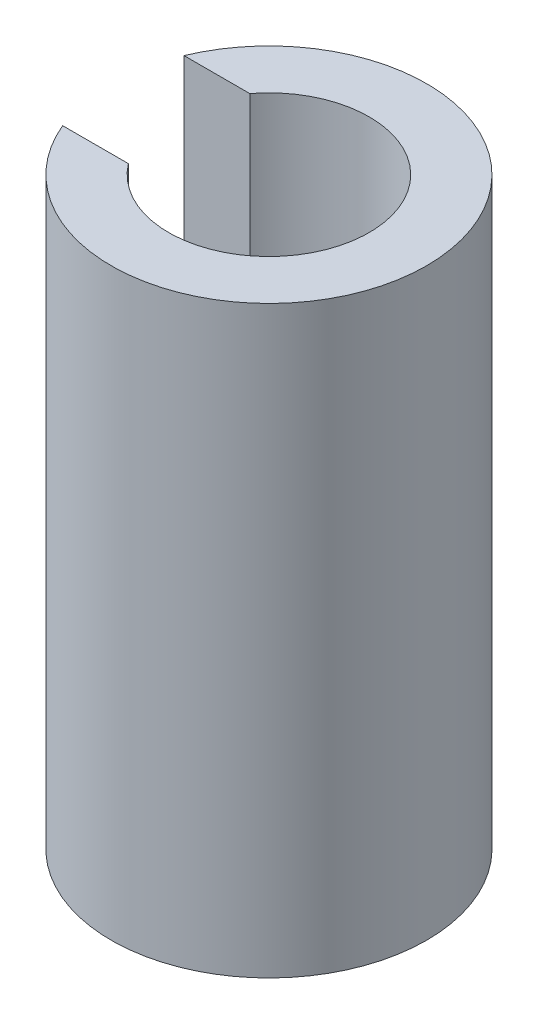
from build123d import *

# Parameters (mm, degrees)
SKETCH_1_R          = 4.05
SKETCH_1_R_2        = 2.575
EXTRUDE_1_DEPTH     = 15
SKETCH_2_W          = 2
SKETCH_2_H          = 3.116488408
CUT_EXTRUDE_1_DEPTH = 15
EXTRUDE_2_DEPTH     = 1


with BuildPart() as part:
    # 草圖1 → 填料-伸長1 (new body)
    with BuildSketch(Plane(origin=(0, 0, 0), x_dir=(1, 0, 0), z_dir=(0, 1, 0))):
        Circle(SKETCH_1_R)
        Circle(SKETCH_1_R_2, mode=Mode.SUBTRACT)
    extrude(amount=EXTRUDE_1_DEPTH)

    # 草圖2 → 除料-伸長1 (cut)
    with BuildSketch(Plane(origin=(0, 15, 0), x_dir=(1, 0, 0), z_dir=(0, 1, 0))):
        with Locations((-3.05, 0)):
            Rectangle(SKETCH_2_W, SKETCH_2_H)
    extrude(amount=-CUT_EXTRUDE_1_DEPTH, mode=Mode.SUBTRACT)


with BuildPart() as body_2:
    # 草圖3 → 填料-伸長2 (new body)
    with BuildSketch(Plane.XZ):
        with BuildLine():
            Line((1.145643924, 0.5), (2.525989905, 0.5))
            ThreePointArc((2.525989905, 0.5), (2.575, 0), (2.525989905, -0.5))
            Line((2.525989905, -0.5), (1.145643924, -0.5))
            ThreePointArc((1.145643924, -0.5), (-1.25, 0), (1.145643924, 0.5))
        make_face()
    extrude(amount=-EXTRUDE_2_DEPTH)


solid = Compound([part.part, body_2.part])
